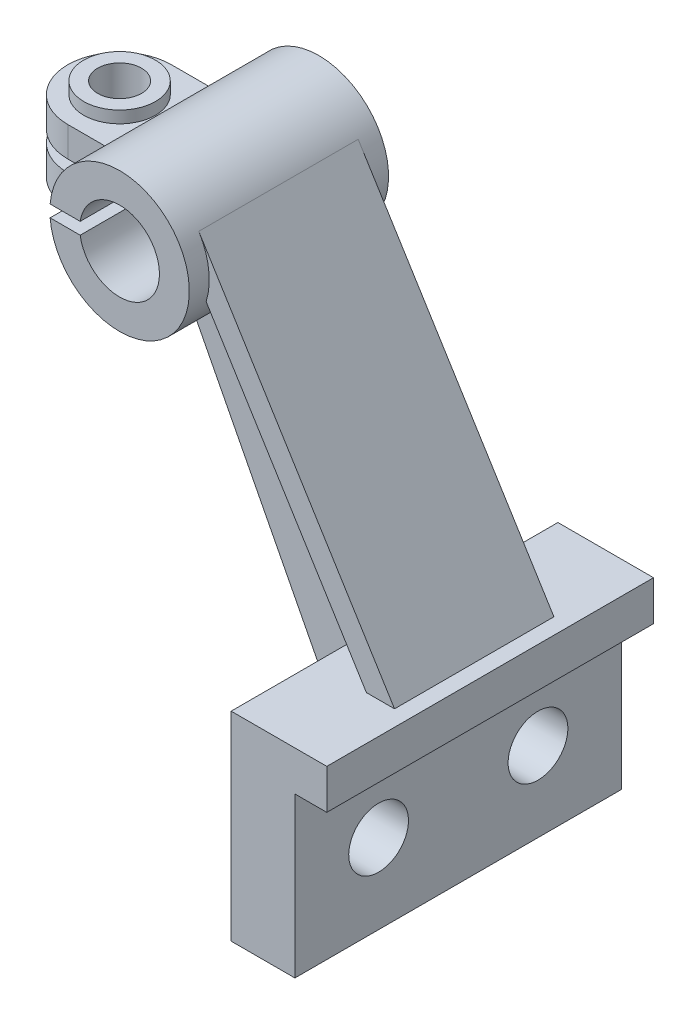
from build123d import *

# Parameters (mm, degrees)
SKETCH_1_R               = 17.5
EXTRUDE_1_DEPTH          = 25
EXTRUDE_2_DEPTH          = 9
SKETCH_3_R               = 9
EXTRUDE_3_DEPTH          = 3
CUT_EXTRUDE_1_DEPTH      = 49.736536602
CUT_EXTRUDE_1_DEPTH_BACK = 49.736536602
SKETCH_4_W               = 40.777628878
SKETCH_4_H               = 3
CUT_EXTRUDE_2_DEPTH      = 66.193941436
CUT_EXTRUDE_2_DEPTH_BACK = 66.193941436
SKETCH_5_R               = 10
CUT_EXTRUDE_3_REACH      = 56.215
SKETCH_6_R               = 5.5
HOLE_WIZARD_M10_1_D      = 8.5
SKETCH_9_W               = 16
SKETCH_9_H               = 50
EXTRUDE_4_DEPTH          = 41
SKETCH_10_W              = 82
SKETCH_10_H              = 10
EXTRUDE_5_DEPTH          = 8
EXTRUDE_6_DEPTH          = 4
EXTRUDE_7_DEPTH          = 20
SKETCH_13_R              = 14
CUT_EXTRUDE_4_DEPTH      = 3
SKETCH_14_R              = 7.5
CUT_EXTRUDE_5_DEPTH      = 153.663027613


with BuildPart() as part:
    # 草图1 → 凸台-拉伸1 (new, symmetric)
    with BuildSketch(Plane.XY):
        Circle(SKETCH_1_R)
    extrude(amount=EXTRUDE_1_DEPTH, both=True)

    # 草图2 → 凸台-拉伸2 (add, symmetric)
    with BuildSketch(Plane(origin=(0, 0, 0), x_dir=(1, 0, 0), z_dir=(0, 1, 0))):
        with BuildLine():
            Line((0, -13), (-25, -13))
            ThreePointArc((-25, -13), (-38, 0), (-25, 13))
            Line((-25, 13), (0, 13))
            ThreePointArc((0, 13), (13, 0), (0, -13))
        make_face()
    extrude(amount=EXTRUDE_2_DEPTH, both=True)

    # 草图3 → 凸台-拉伸3 (add)
    with BuildSketch(Plane(origin=(0, 9, 0), x_dir=(1, 0, 0), z_dir=(0, 1, 0))):
        with Locations(Location((-25, 0, 0), (0, 0, 270))):
            Circle(SKETCH_3_R)
    extrude(amount=EXTRUDE_3_DEPTH)

    # 草图4 → 切除-拉伸1 (cut, two sides: drawn at the far end of the back side and taken through both)
    with BuildSketch(Plane.XY.offset(-CUT_EXTRUDE_1_DEPTH_BACK)):
        with Locations((-20.388814439, 0)):
            Rectangle(SKETCH_4_W, SKETCH_4_H)
    extrude(amount=CUT_EXTRUDE_1_DEPTH + CUT_EXTRUDE_1_DEPTH_BACK, mode=Mode.SUBTRACT)

    # 草图5 → 切除-拉伸2 (cut, two sides: drawn at the far end of the back side and taken through both)
    with BuildSketch(Plane.XY.offset(25).offset(-CUT_EXTRUDE_2_DEPTH_BACK)):
        Circle(SKETCH_5_R)
    extrude(amount=CUT_EXTRUDE_2_DEPTH + CUT_EXTRUDE_2_DEPTH_BACK, mode=Mode.SUBTRACT)

    # 草图6 → 切除-拉伸3 (cut, up to next)
    with BuildSketch(Plane(origin=(0, 12, 0), x_dir=(1, 0, 0), z_dir=(0, 1, 0)), mode=Mode.PRIVATE) as cut_extrude_3_sk1:
        with Locations(Location((-25, 0, 0), (0, 0, 270))):
            Circle(SKETCH_6_R)
    cut_extrude_3_tool1 = extrude(cut_extrude_3_sk1.sketch, amount=-CUT_EXTRUDE_3_REACH, mode=Mode.PRIVATE) & part.part
    add(cut_extrude_3_tool1.solids().sort_by_distance((-25, 12, 0))[0], mode=Mode.SUBTRACT)

    # M10 螺纹孔1 (through all)
    with Locations(Plane(origin=(0, -1.5, 0), x_dir=(1, 0, 0), z_dir=(0, 1, 0))):
        with Locations((-25, 0)):
            Hole(HOLE_WIZARD_M10_1_D / 2)



with BuildPart() as body_2:
    # 草图9 → 凸台-拉伸4 (new, symmetric)
    with BuildSketch(Plane.XY):
        with Locations((52, -95)):
            Rectangle(SKETCH_9_W, SKETCH_9_H)
    extrude(amount=EXTRUDE_4_DEPTH, both=True)

    # 草图10 → 凸台-拉伸5 (add)
    with BuildSketch(Plane(origin=(60, 0, 0), x_dir=(0, 0, -1), z_dir=(1, 0, 0))):
        with Locations((0, -75)):
            Rectangle(SKETCH_10_W, SKETCH_10_H)
    extrude(amount=EXTRUDE_5_DEPTH)


with BuildPart() as part_1:
    add(part.part)

    add(body_2.part)  # 凸台-拉伸6 merges body 2
    # 草图11 → 凸台-拉伸6 (add, symmetric)
    with BuildSketch(Plane.XY):
        with BuildLine():
            Line((-7, -16.039014932), (44, -115))
            Line((44, -115), (44, -70))
            Line((44, -70), (64, -70))
            Line((64, -70), (14.872506114, 9.222719875))
            ThreePointArc((14.872506114, 9.222719875), (13.229999981, -11.455003295), (-7, -16.039014932))
        make_face()
    extrude(amount=EXTRUDE_6_DEPTH, both=True)

    # 草图12 → 凸台-拉伸7 (add, symmetric)
    with BuildSketch(Plane.XY):
        with BuildLine():
            Line((64, -70), (14.872506114, 9.222719875))
            ThreePointArc((14.872506114, 9.222719875), (17.356401201, 2.237261127), (16.725134335, -5.149745768))
            Line((16.725134335, -5.149745768), (56.939992816, -70))
            Line((56.939992816, -70), (64, -70))
        make_face()
    extrude(amount=EXTRUDE_7_DEPTH, both=True)

    # 草图13 → 切除-拉伸4 (cut)
    with BuildSketch(Plane.ZY.offset(-44)):
        with Locations(Location((-20, -100, 0), (0, 0, 270))):
            Circle(SKETCH_13_R)
    cut_extrude_4 = extrude(amount=-CUT_EXTRUDE_4_DEPTH, mode=Mode.SUBTRACT)

    # 草图14 → 切除-拉伸5 (cut, through all)
    with BuildSketch(Plane.ZY.offset(-47)):
        with Locations(Location((-20, -100, 0), (0, 0, 270))):
            Circle(SKETCH_14_R)
    cut_extrude_5 = extrude(amount=-CUT_EXTRUDE_5_DEPTH, mode=Mode.SUBTRACT)

    # 镜向1: 切除-拉伸4, 切除-拉伸5 across plane
    add(cut_extrude_4.mirror(Plane.XY), mode=Mode.SUBTRACT)
    add(cut_extrude_5.mirror(Plane.XY), mode=Mode.SUBTRACT)


solid = part_1.part
